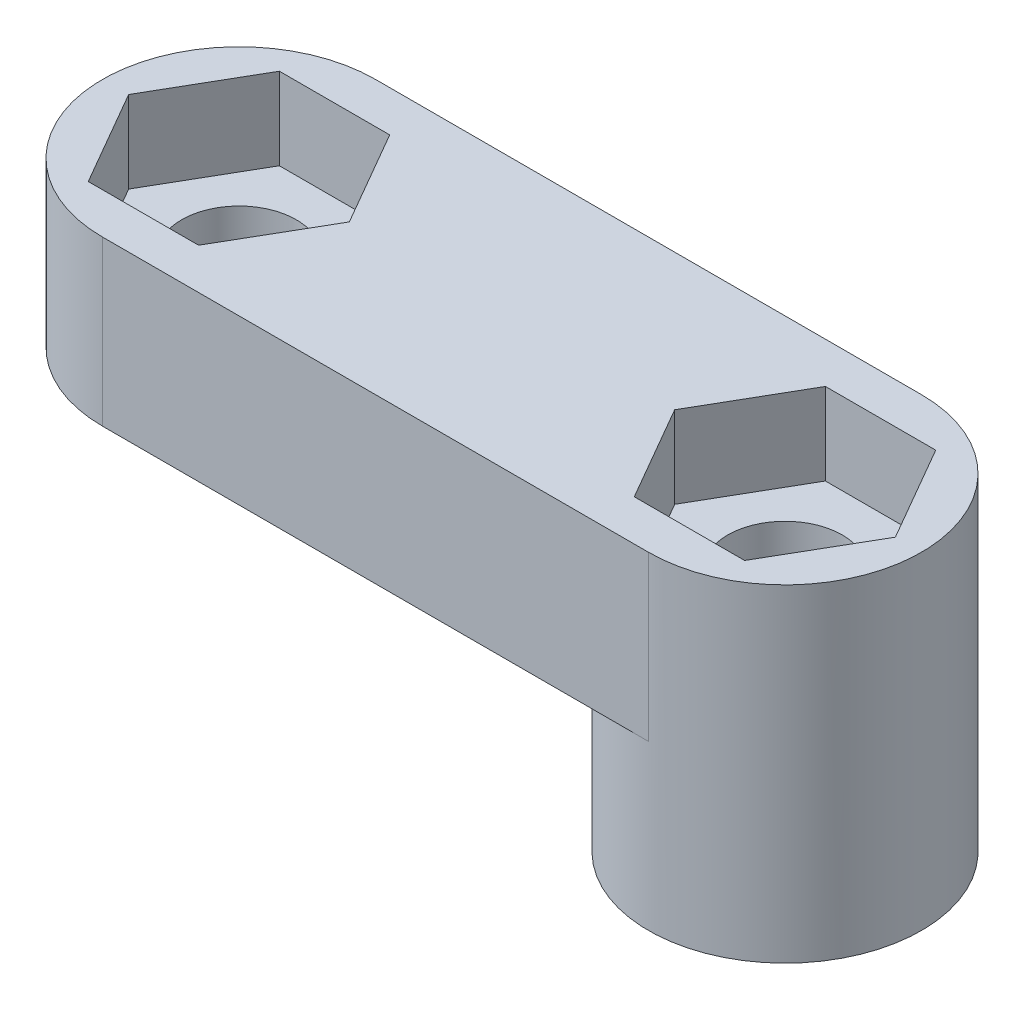
from build123d import *

# Parameters (mm, degrees)
SKETCH1_R           = 2.1
BOSS_EXTRUDE1_DEPTH = 3
CUT_EXTRUDE1_DEPTH  = 3
SKETCH3_R           = 5
SKETCH3_R_2         = 2.1
BOSS_EXTRUDE2_DEPTH = 6


with BuildPart() as part:
    # Sketch1 → Boss-Extrude1 (new, symmetric)
    with BuildSketch(Plane(origin=(0, 0, 0), x_dir=(1, 0, 0), z_dir=(0, 1, 0))):
        with BuildLine():
            Line((-10, 5), (10, 5))
            ThreePointArc((10, 5), (15, 0), (10, -5))
            Line((10, -5), (-10, -5))
            ThreePointArc((-10, -5), (-15, 0), (-10, 5))
        make_face()
        with Locations(Location((10, 0, 0), (0, 0, 270))):
            Circle(SKETCH1_R, mode=Mode.SUBTRACT)
        with Locations(Location((-10, 0, 0), (0, 0, 270))):
            Circle(SKETCH1_R, mode=Mode.SUBTRACT)
    extrude(amount=BOSS_EXTRUDE1_DEPTH, both=True)

    # Sketch2 → Cut-Extrude1 (cut)
    with BuildSketch(Plane(origin=(0, 3, 0), x_dir=(1, 0, 0), z_dir=(0, 1, 0))):
        Polygon((-5.958548116, 0), (-7.979274058, 3.5), (-12.020725942, 3.5), (-14.041451884, 0), (-12.020725942, -3.5), (-7.979274058, -3.5), align=None)
        Polygon((14.041451884, 0), (12.020725942, 3.5), (7.979274058, 3.5), (5.958548116, 0), (7.979274058, -3.5), (12.020725942, -3.5), align=None)
    extrude(amount=-CUT_EXTRUDE1_DEPTH, mode=Mode.SUBTRACT)

    # Sketch3 → Boss-Extrude2 (add)
    with BuildSketch(Plane.XZ.offset(3)):
        with Locations(Location((10, 0, 0), (0, 0, 270))):
            Circle(SKETCH3_R)
        with Locations(Location((10, 0, 0), (0, 0, 270))):
            Circle(SKETCH3_R_2, mode=Mode.SUBTRACT)
    extrude(amount=BOSS_EXTRUDE2_DEPTH)


solid = part.part
